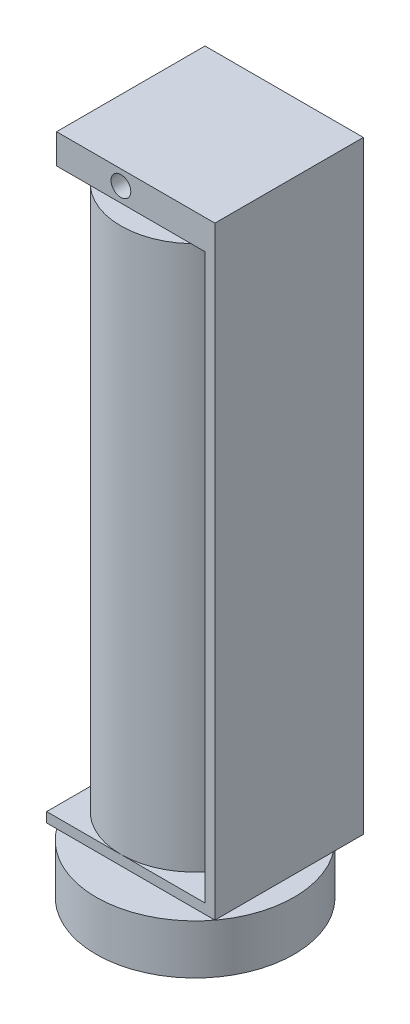
from build123d import *

# Parameters (mm, degrees)
SKETCH1_R          = 20
EXTRUDE1_DEPTH     = 10
SKETCH2_R          = 2
EXTRUDE2_DEPTH     = 5
SKETCH3_R          = 15
EXTRUDE3_DEPTH     = 110
SKETCH4_W          = 34
SKETCH4_H          = 30
EXTRUDE4_DEPTH     = 2
SKETCH5_W          = 2
SKETCH5_H          = 30
EXTRUDE5_DEPTH     = 120
SKETCH6_W          = 30
SKETCH6_H          = 6
EXTRUDE6_DEPTH     = 30
SKETCH7_R          = 2
CUT_EXTRUDE1_DEPTH = 30


with BuildPart() as part:
    # Sketch1 → Extrude1 (new body)
    with BuildSketch(Plane(origin=(0, 0, 0), x_dir=(1, 0, 0), z_dir=(0, 1, 0))):
        with Locations(Location((0, 0, 0), (0, 0, 270))):
            Circle(SKETCH1_R)
    extrude(amount=EXTRUDE1_DEPTH)

    # Sketch2 → Extrude2 (add)
    with BuildSketch(Plane(origin=(0, 10, 0), x_dir=(1, 0, 0), z_dir=(0, 1, 0))):
        with Locations(Location((0, 0, 0), (0, 0, 270))):
            Circle(SKETCH2_R)
    extrude(amount=EXTRUDE2_DEPTH)

    # Sketch3 → Extrude3 (add)
    with BuildSketch(Plane(origin=(0, 15, 0), x_dir=(1, 0, 0), z_dir=(0, 1, 0))):
        with Locations(Location((0, 0, 0), (0, 0, 270))):
            Circle(SKETCH3_R)
    extrude(amount=EXTRUDE3_DEPTH)

    # Sketch4 → Extrude4 (add)
    with BuildSketch(Plane.XZ.offset(-15)):
        with Locations((2, 0)):
            Rectangle(SKETCH4_W, SKETCH4_H)
    extrude(amount=EXTRUDE4_DEPTH)

    # Sketch5 → Extrude5 (add)
    with BuildSketch(Plane(origin=(0, 15, 0), x_dir=(1, 0, 0), z_dir=(0, 1, 0))):
        with Locations((18, 0)):
            Rectangle(SKETCH5_W, SKETCH5_H)
    extrude(amount=EXTRUDE5_DEPTH)

    # Sketch6 → Extrude6 (add)
    with BuildSketch(Plane.ZY.offset(-17)):
        with Locations((0, 132)):
            Rectangle(SKETCH6_W, SKETCH6_H)
    extrude(amount=EXTRUDE6_DEPTH)

    # Sketch7 → Cut-Extrude1 (cut)
    with BuildSketch(Plane.XY.offset(15)):
        with Locations((0.0001, 132)):
            Circle(SKETCH7_R)
    extrude(amount=-CUT_EXTRUDE1_DEPTH, mode=Mode.SUBTRACT)


solid = part.part
